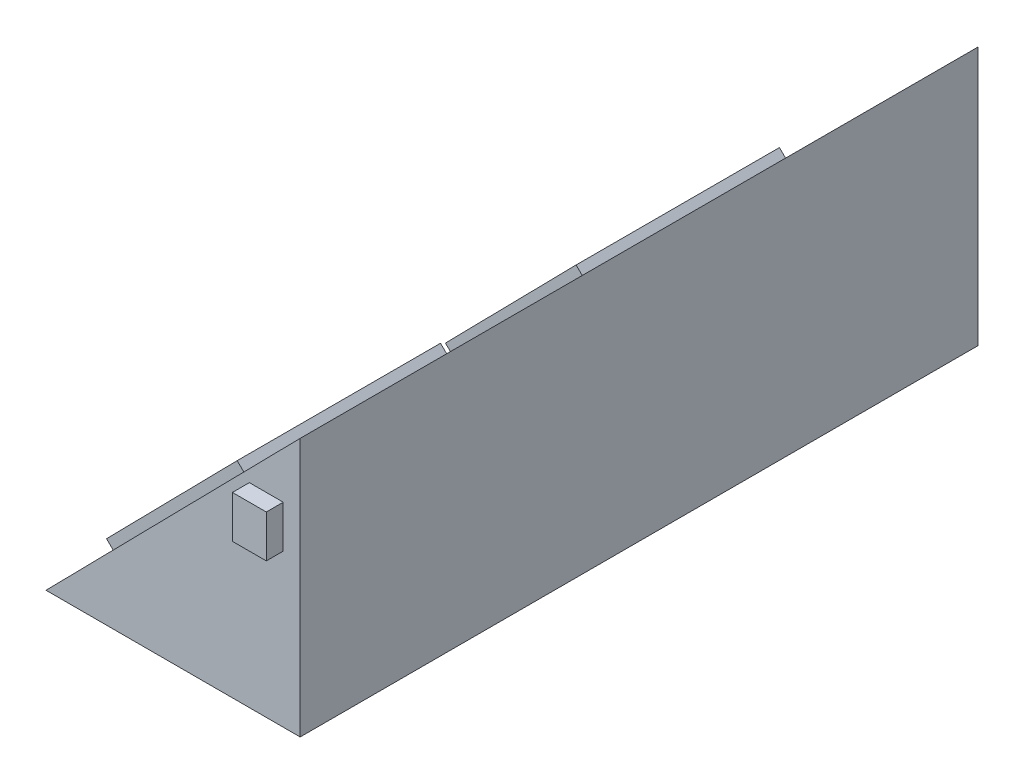
from build123d import *

# Parameters (mm, degrees)
BOSS_EXTRUDE1_DEPTH = 101.6
SKETCH2_W           = 5.08
SKETCH2_H           = 6.35
BOSS_EXTRUDE2_DEPTH = 2.54
BOSS_EXTRUDE3_START = -101.6
SKETCH2_2_W         = 5.08
SKETCH2_2_H         = 6.35
BOSS_EXTRUDE3_DEPTH = 2.54
BOSS_EXTRUDE4_DEPTH = 1.524


with BuildPart() as part:
    # Sketch1 → Boss-Extrude1 (new body)
    with BuildSketch(Plane.XY):
        Polygon((0, 0), (38.1, 38.770841672), (38.1, 0), align=None)
    extrude(amount=BOSS_EXTRUDE1_DEPTH)

    # Sketch2 → Boss-Extrude2 (add)
    with BuildSketch(Plane.XY.offset(101.6)):
        with Locations((33.02, 26.035)):
            Rectangle(SKETCH2_W, SKETCH2_H)
    extrude(amount=BOSS_EXTRUDE2_DEPTH)

    # Sketch2<2> → Boss-Extrude3 (add)
    with BuildSketch(Plane.XY.offset(101.6).offset(BOSS_EXTRUDE3_START)):
        with Locations((33.02, 26.035)):
            Rectangle(SKETCH2_2_W, SKETCH2_2_H)
    extrude(amount=-BOSS_EXTRUDE3_DEPTH)

    # Sketch3 → Boss-Extrude4 (add)
    with BuildSketch(Plane(origin=(0, 0, 0), x_dir=(0, 0, 1), z_dir=(-0.7132504491541779, 0.7009092642998548, 0))):
        Polygon((12.7, 0), (12.7, 25.4), (38.1, 25.4), (38.1, 0), (40.64, 0), (40.64, 27.94), (10.16, 27.94), (10.16, 0), align=None)
        Polygon((88.9, 0), (88.9, 25.4), (63.5, 25.4), (63.5, 0), (60.96, 0), (60.96, 27.94), (91.44, 27.94), (91.44, 0), align=None)
    extrude(amount=BOSS_EXTRUDE4_DEPTH)


solid = part.part
